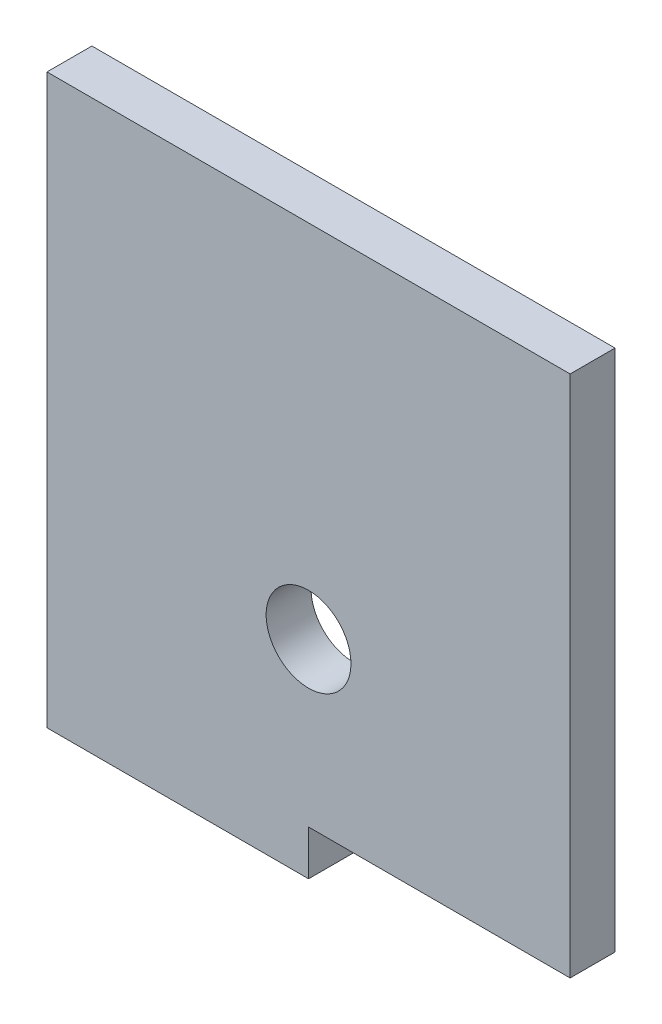
from build123d import *

# Parameters (mm, degrees)
SKETCH1_R           = 3
BOSS_EXTRUDE1_DEPTH = 3.175


with BuildPart() as part:
    # Sketch1 → Boss-Extrude1 (new body)
    with BuildSketch(Plane.XY):
        Polygon((18.5, 0), (18.5, -3.175), (0, -3.175), (0, 0), (0, 37), (37, 37), (37, 0), align=None)
        with Locations((18.5, 11.5)):
            Circle(SKETCH1_R, mode=Mode.SUBTRACT)
    extrude(amount=BOSS_EXTRUDE1_DEPTH)


solid = part.part
